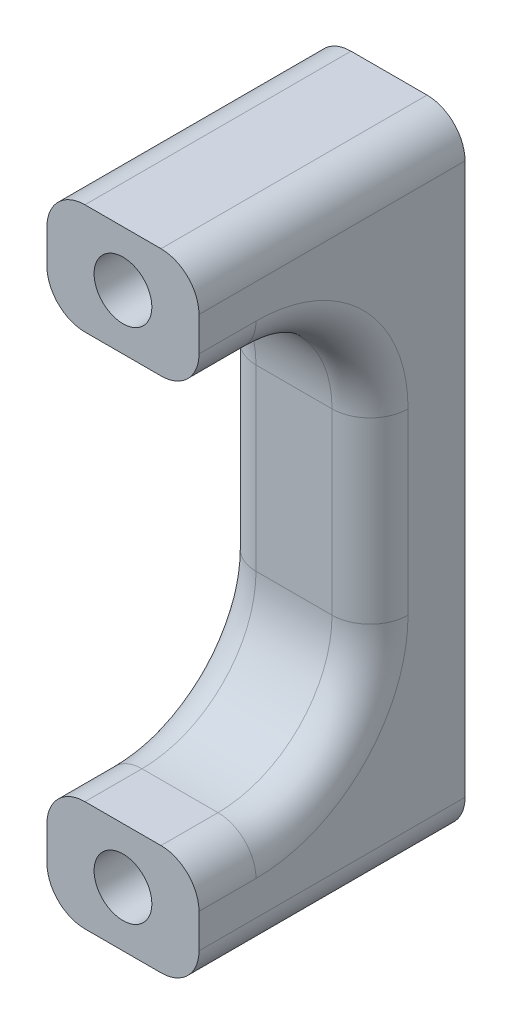
from build123d import *

# Parameters (mm, degrees)
SKETCH1_W                   = 10.16
SKETCH1_H                   = 41.91
BOSS_EXTRUDE1_DEPTH         = 17.78
SKETCH2_W                   = 10.16
SKETCH2_H                   = 27.178
CUT_EXTRUDE1_DEPTH          = 11.43
F_24_0_152_DIAMETER_HOLE1_D = 3.8608
FILLET1_R                   = 7.62
FILLET2_R                   = 2.54


with BuildPart() as part:
    # Sketch1 → Boss-Extrude1 (new body)
    with BuildSketch(Plane.XY):
        with Locations((5.08, 20.955)):
            Rectangle(SKETCH1_W, SKETCH1_H)
    extrude(amount=BOSS_EXTRUDE1_DEPTH)

    # Sketch2 → Cut-Extrude1 (cut)
    with BuildSketch(Plane.XY.offset(17.78)):
        with Locations((5.08, 20.955)):
            Rectangle(SKETCH2_W, SKETCH2_H)
    extrude(amount=-CUT_EXTRUDE1_DEPTH, mode=Mode.SUBTRACT)

    # #24 (0.152) Diameter Hole1 (through all)
    with Locations(Plane.XY.offset(17.78)):
        with Locations((5.08, 3.683), (5.08, 38.227)):
            Hole(F_24_0_152_DIAMETER_HOLE1_D / 2)

    # Fillet1
    fillet1_edges = [part.edges().sort_by_distance(p)[0] for p in [
        (5.08, 7.366, 6.35),
        (5.08, 34.544, 6.35),
    ]]
    fillet(fillet1_edges, radius=FILLET1_R)

    # Fillet2
    fillet2_edges = [part.edges().sort_by_distance(p)[0] for p in [
        (0, 20.955, 6.35),
        (10.16, 20.955, 6.35),
        (0, 7.366, 15.875),
        (10.16, 7.366, 15.875),
        (10.16, 34.544, 15.875),
        (0, 34.544, 15.875),
        (10.16, 9.597846327, 8.581846327),
        (0, 9.597846327, 8.581846327),
        (0, 32.312153673, 8.581846327),
        (10.16, 32.312153673, 8.581846327),
        (0, 41.91, 8.89),
        (10.16, 41.91, 8.89),
        (10.16, 0, 8.89),
        (0, 0, 8.89),
    ]]
    fillet(fillet2_edges, radius=FILLET2_R)


solid = part.part
